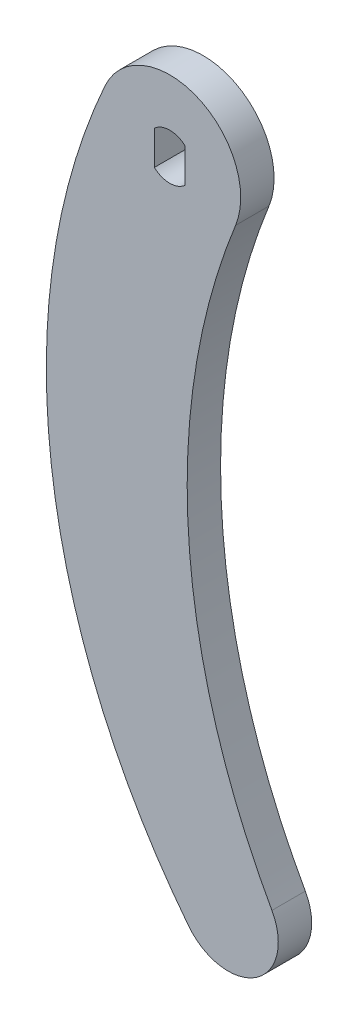
from build123d import *

# Parameters (mm, degrees)
BOSS_EXTRUDE1_DEPTH = 4


with BuildPart() as part:
    # Sketch1 → Boss-Extrude1 (new body)
    with BuildSketch(Plane.XY):
        with BuildLine():
            ThreePointArc((7.884132017, -3.176548808), (3.33142336, 7.819950025), (-7.75272605, 3.485001979))
            ThreePointArc((-7.75272605, 3.485001979), (-14.196448744, -39.008497905), (2.279937241, -78.704187839))
            ThreePointArc((2.279937241, -78.704187839), (10.324774467, -79.994584542), (12.238678661, -72.074893868))
            ThreePointArc((12.238678661, -72.074893868), (2.247032536, -38.119609121), (7.884132017, -3.176548808))
        make_face()
        with BuildLine():
            Line((-1.85, -2.04), (-1.85, 2.04))
            ThreePointArc((-1.85, 2.04), (0, 2.753924472), (1.85, 2.04))
            Line((1.85, 2.04), (1.85, -2.04))
            ThreePointArc((1.85, -2.04), (0, -2.753924472), (-1.85, -2.04))
        make_face(mode=Mode.SUBTRACT)
    extrude(amount=BOSS_EXTRUDE1_DEPTH)


solid = part.part
